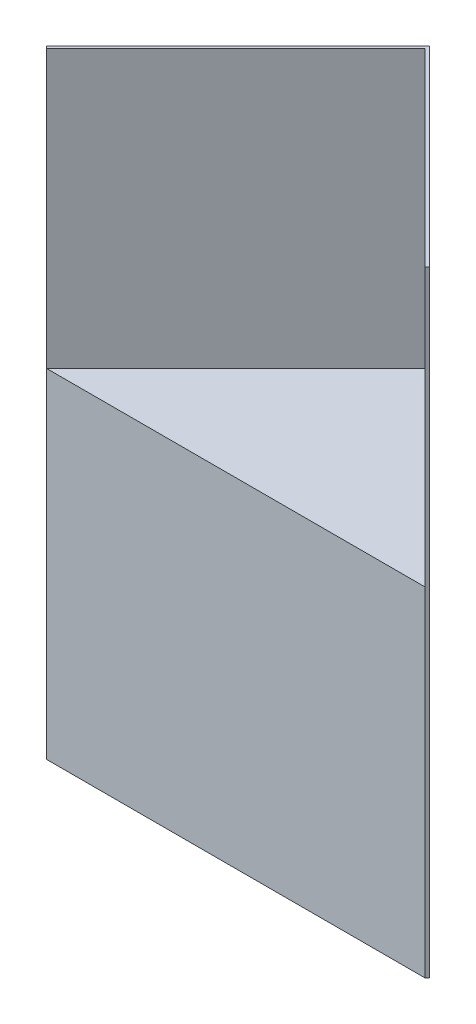
from build123d import *

# Parameters (mm, degrees)
BOSS_EXTRUDE1_DEPTH = 1397
BOSS_EXTRUDE2_DEPTH = 2540


with BuildPart() as part:
    # Sketch2 → Boss-Extrude1 (new body)
    with BuildSketch(Plane(origin=(0, 0, 0), x_dir=(1, 0, 0), z_dir=(0, 1, 0))):
        Polygon((0, 0), (-781.05, -781.05), (781.05, -781.05), align=None)
    extrude(amount=BOSS_EXTRUDE1_DEPTH)

    # Sketch3 → Boss-Extrude2 (add)
    with BuildSketch(Plane(origin=(0, 0, 0), x_dir=(1, 0, 0), z_dir=(0, 1, 0))):
        Polygon((790.030256121, -772.069743879), (0, 17.960512242), (-790.030256121, -772.069743879), (-781.05, -781.05), (0, 0), (781.05, -781.05), align=None)
    extrude(amount=BOSS_EXTRUDE2_DEPTH)


solid = part.part
